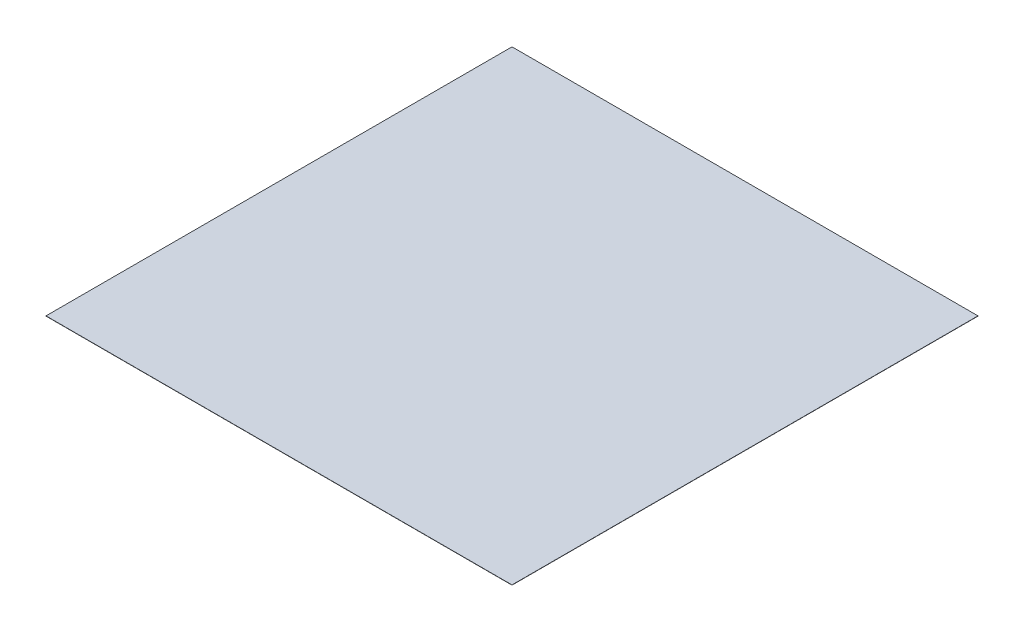
from build123d import *

# Parameters (mm, degrees)
SKETCH_1_W      = 4000
SKETCH_1_H      = 4000
EXTRUDE_1_DEPTH = 2


with BuildPart() as part:
    # Эскиз1 → Бобышка-Вытянуть1 (new body)
    with BuildSketch(Plane(origin=(0, 0, 0), x_dir=(1, 0, 0), z_dir=(0, 1, 0))):
        Rectangle(SKETCH_1_W, SKETCH_1_H)
    extrude(amount=EXTRUDE_1_DEPTH)


solid = part.part
